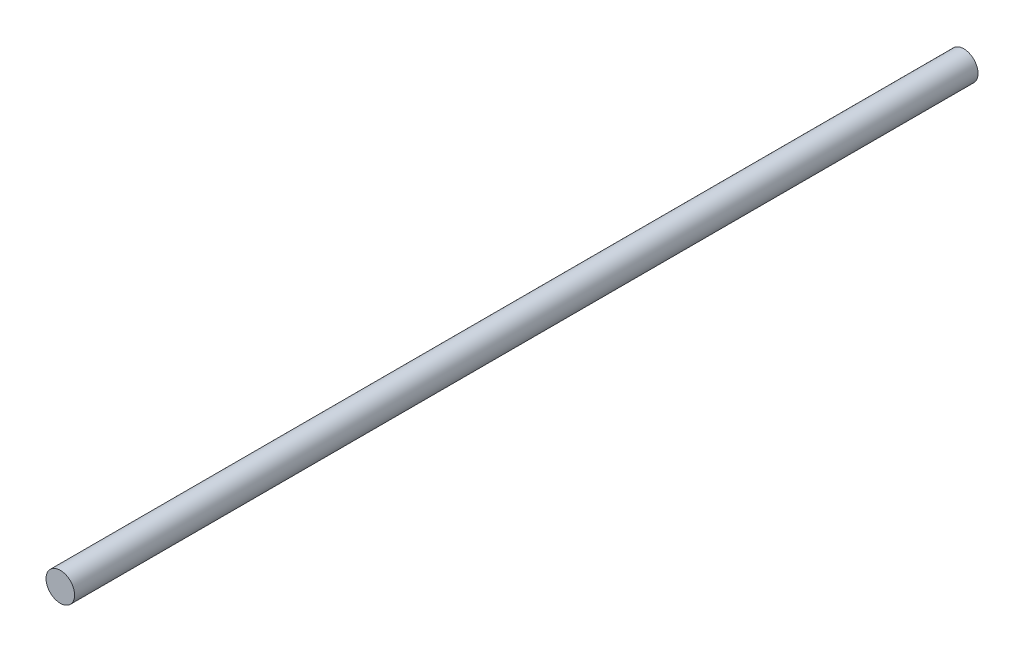
from build123d import *

# Parameters (mm, degrees)
SKETCH1_R           = 2.413
BOSS_EXTRUDE1_DEPTH = 152.4


with BuildPart() as part:
    # Sketch1 → Boss-Extrude1 (new body)
    with BuildSketch(Plane.XY):
        with Locations(Location((0, 0, 0), (0, 0, 180))):
            Circle(SKETCH1_R)
    extrude(amount=BOSS_EXTRUDE1_DEPTH)


solid = part.part
